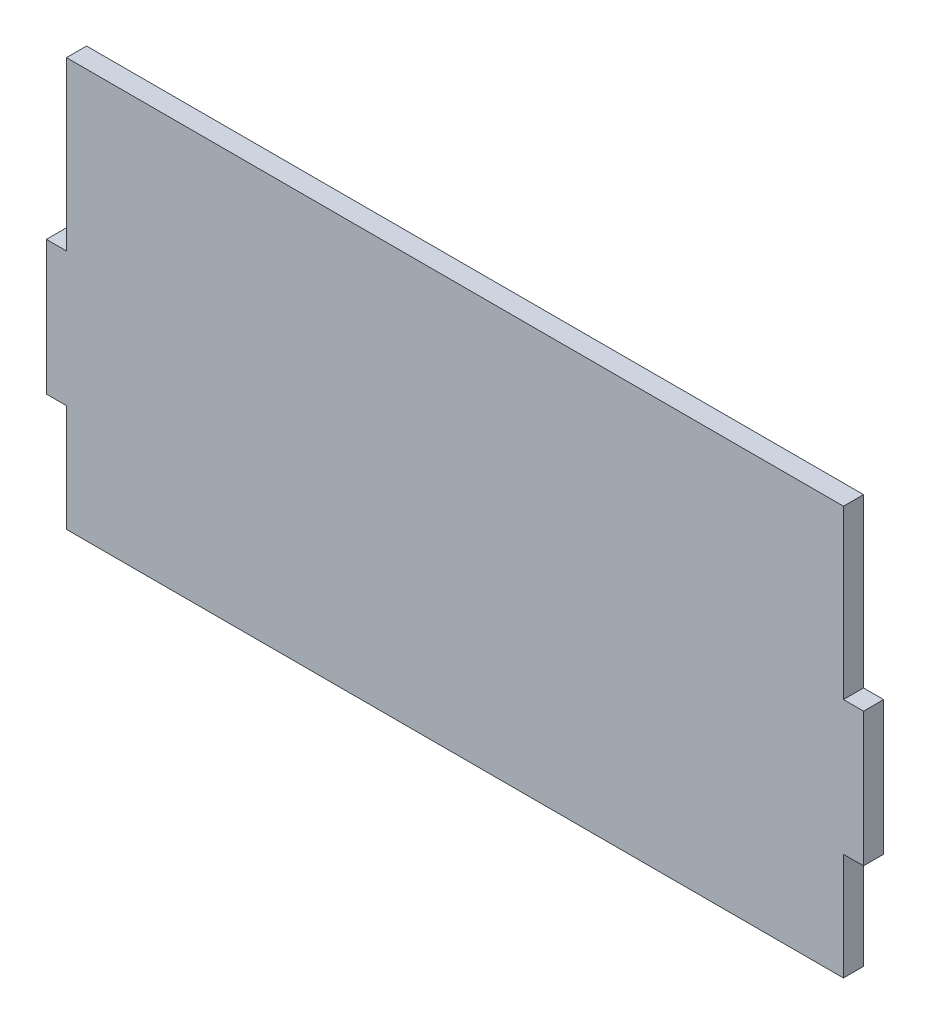
from build123d import *

# Parameters (mm, degrees)
BOSS_EXTRUDE1_DEPTH = 3


with BuildPart() as part:
    # Sketch1 → Boss-Extrude1 (new body)
    with BuildSketch(Plane.XY):
        Polygon((-58, 35), (58, 35), (58, 10), (61, 10), (61, -10), (58, -10), (58, -26), (-58, -26), (-58, -10), (-61, -10), (-61, 10), (-58, 10), align=None)
    extrude(amount=BOSS_EXTRUDE1_DEPTH)


solid = part.part
